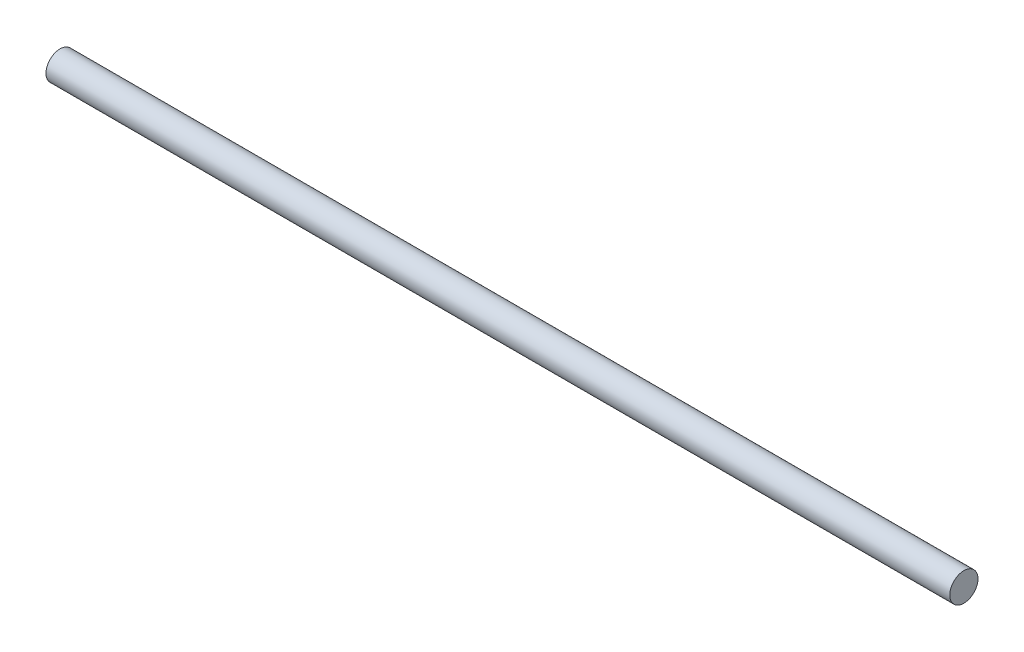
from build123d import *

# Parameters (mm, degrees)
SKETCH1_R           = 1.5875
BOSS_EXTRUDE1_DEPTH = 50.8


with BuildPart() as part:
    # Sketch1 → Boss-Extrude1 (new, symmetric)
    with BuildSketch(Plane(origin=(0, 0, 0), x_dir=(0, 0, -1), z_dir=(1, 0, 0))):
        Circle(SKETCH1_R)
    extrude(amount=BOSS_EXTRUDE1_DEPTH, both=True)


solid = part.part
